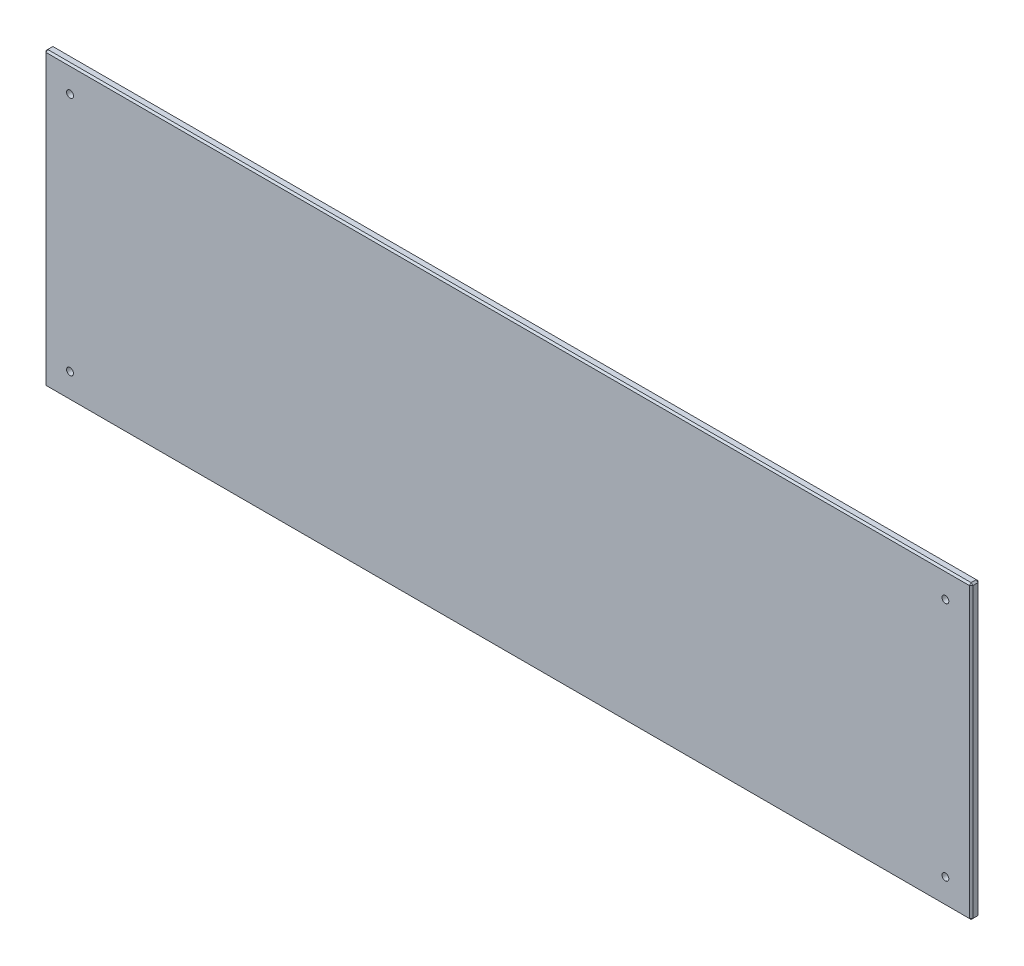
from build123d import *

# Parameters (mm, degrees)
SKETCH1_W           = 540
SKETCH1_H           = 170
BOSS_EXTRUDE1_DEPTH = 5
CHAMFER1_SIZE       = 1
SKETCH2_R           = 2
CUT_EXTRUDE1_DEPTH  = 5


with BuildPart() as part:
    # Sketch1 → Boss-Extrude1 (new body)
    with BuildSketch(Plane.XY):
        with Locations((270, 85)):
            Rectangle(SKETCH1_W, SKETCH1_H)
    extrude(amount=BOSS_EXTRUDE1_DEPTH)

    # Chamfer1
    chamfer1_edges = [part.edges().sort_by_distance(p)[0] for p in [
        (540, 85, 5),
        (270, 170, 5),
        (0, 85, 5),
        (270, 170, 0),
        (540, 85, 0),
        (270, 0, 0),
        (0, 85, 0),
        (0, 170, 2.5),
        (540, 170, 2.5),
        (540, 0, 2.5),
        (0, 0, 2.5),
        (270, 0, 5),
    ]]
    chamfer(chamfer1_edges, length=CHAMFER1_SIZE)

    # Sketch2 → Cut-Extrude1 (cut)
    with BuildSketch(Plane.XY.offset(5)):
        with Locations((525, 155)):
            Circle(SKETCH2_R)
        with Locations((525, 15)):
            Circle(SKETCH2_R)
        with Locations((15, 155)):
            Circle(SKETCH2_R)
        with Locations((15, 15)):
            Circle(SKETCH2_R)
    extrude(amount=-CUT_EXTRUDE1_DEPTH, mode=Mode.SUBTRACT)


solid = part.part
